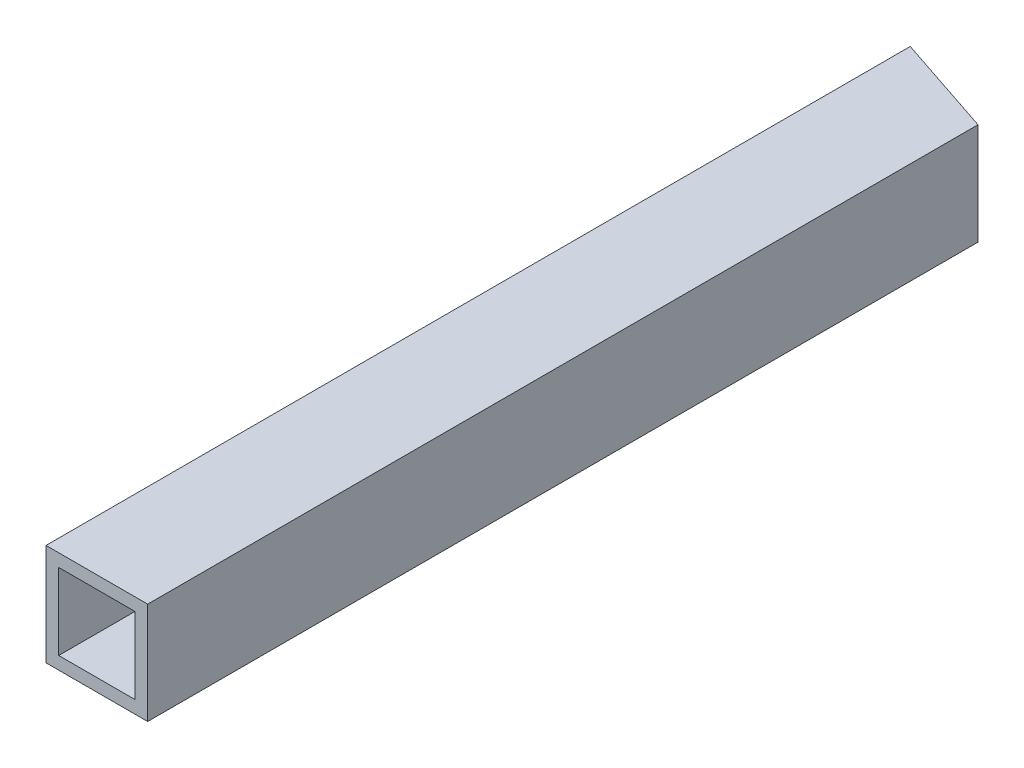
from build123d import *

# Parameters (mm, degrees)
SKETCH1_W           = 25.4
SKETCH1_H           = 25.4
SKETCH1_W_2         = 19.05
SKETCH1_H_2         = 19.05
BOSS_EXTRUDE1_DEPTH = 215.9
CUT_EXTRUDE1_DEPTH  = 219.867836833


with BuildPart() as part:
    # Sketch1 → Boss-Extrude1 (new body)
    with BuildSketch(Plane.XY):
        with Locations((12.7, 12.7)):
            Rectangle(SKETCH1_W, SKETCH1_H)
        with Locations((12.7, 12.7)):
            Rectangle(SKETCH1_W_2, SKETCH1_H_2, mode=Mode.SUBTRACT)
    extrude(amount=BOSS_EXTRUDE1_DEPTH)

    # Sketch2 → Cut-Extrude1 (cut, through all)
    with BuildSketch(Plane(origin=(0, 25.4, 0), x_dir=(1, 0, 0), z_dir=(0, 1, 0))):
        Polygon((0, 0), (25.4, -8.469154802), (25.4, 0), align=None)
    extrude(amount=-CUT_EXTRUDE1_DEPTH, mode=Mode.SUBTRACT)


solid = part.part
